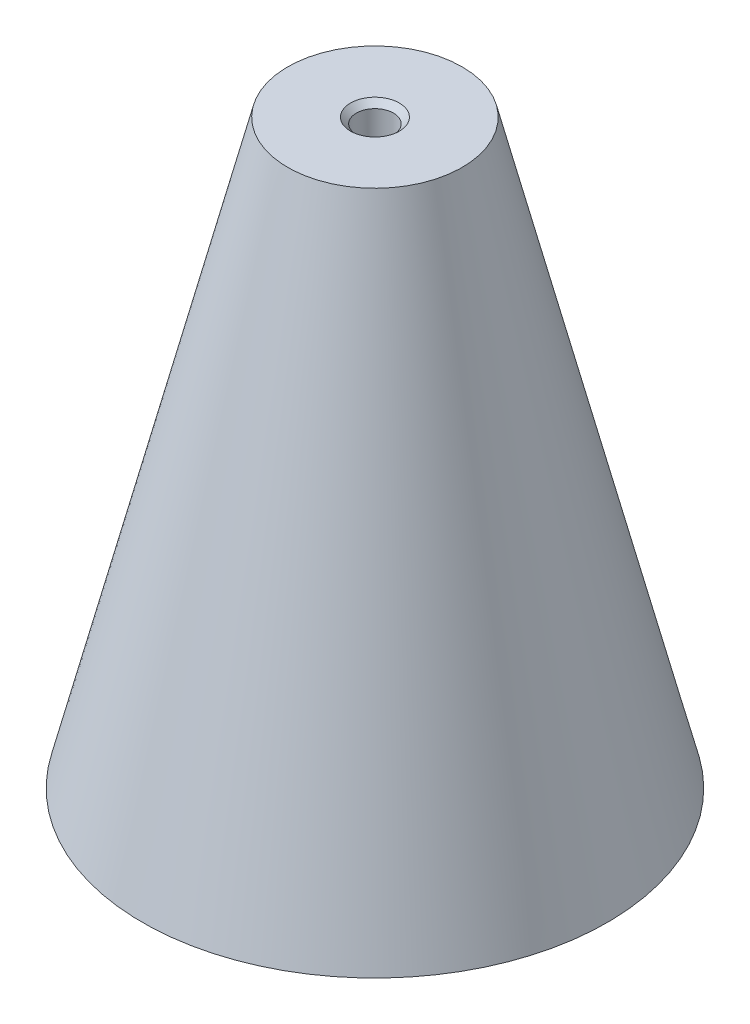
from build123d import *

# Parameters (mm, degrees)
SKETCH_4_R          = 1.6
CUT_EXTRUDE_1_DEPTH = 10
CHAMFER_1_SIZE      = 0.5


with BuildPart() as part:
    # 草图3 → 旋转1 (revolve)
    with BuildSketch(Plane(origin=(0, 0, 0), x_dir=(0, 0, -1), z_dir=(1, 0, 0)), mode=Mode.PRIVATE) as revolve_1_sk:
        Polygon((-7.5, 0), (0, 0), (0, -4), (-4.5, -4), (-16, -50), (-20, -50), align=None)
    revolve(revolve_1_sk.sketch.rotate(Axis((0, 28.450677981, 0), (0, 1, 0)), 180), axis=Axis((0, 28.450677981, 0), (0, 1, 0)))

    # 草图4 → 切除-拉伸1 (cut)
    with BuildSketch(Plane(origin=(0, 0, 0), x_dir=(1, 0, 0), z_dir=(0, 1, 0))):
        with Locations(Location((0, 0, 0), (0, 0, 270))):
            Circle(SKETCH_4_R)
    extrude(amount=-CUT_EXTRUDE_1_DEPTH, mode=Mode.SUBTRACT)

    # 倒角1
    chamfer_1_edges = [part.edges().sort_by_distance(p)[0] for p in [
        (0, -4, -1.6),
        (0, 0, -1.6),
    ]]
    chamfer(chamfer_1_edges, length=CHAMFER_1_SIZE)


solid = part.part
